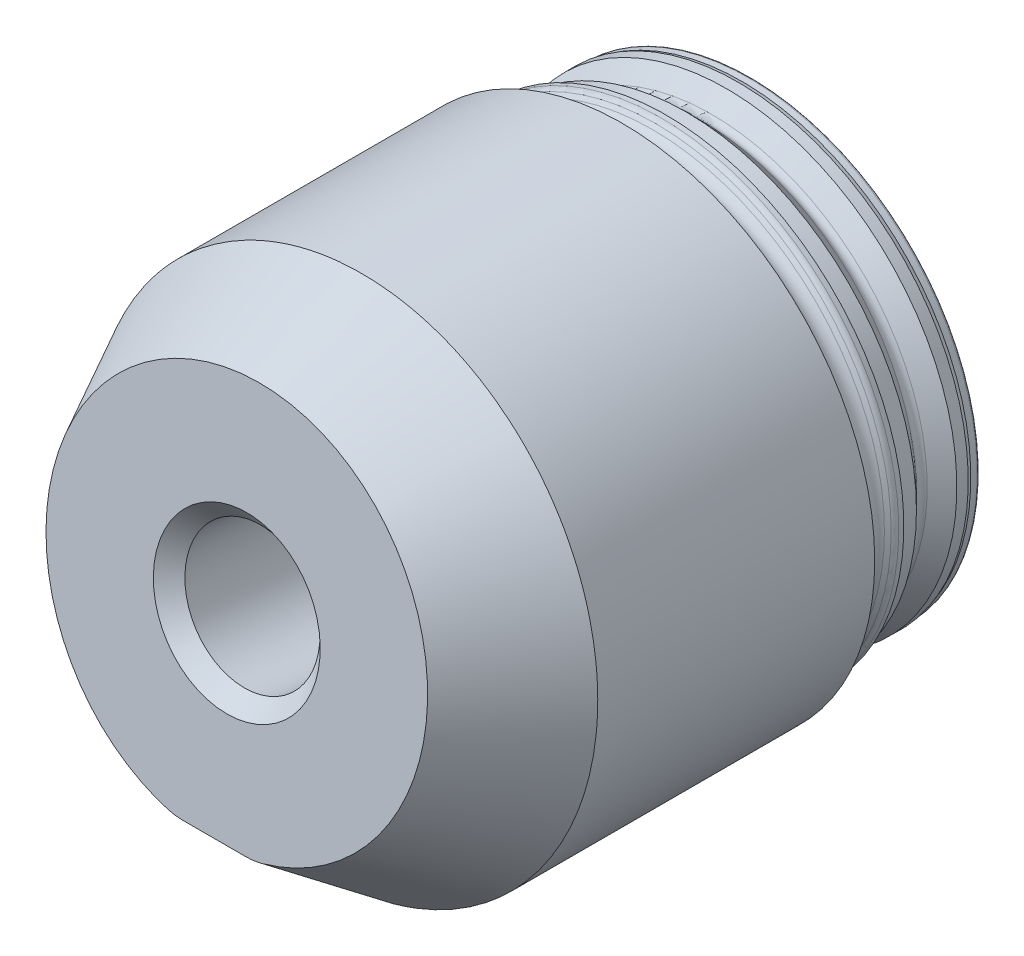
from build123d import *

# Parameters (mm, degrees)
FCE_00_TRIM_END_DEPTH             = 58.943741301
FCE_00_TRIM_END_DEPTH_BACK        = 58.943741301
F_5_8_11_TAPPED_HOLE1_D           = 13.49248
F_5_8_11_TAPPED_HOLE1_DEPTH       = 40.1193
F_5_8_11_TAPPED_HOLE1_CSINK_D     = 16.6624
F_5_8_11_TAPPED_HOLE1_CSINK_ANGLE = 90
F_5_8_11_TAPPED_HOLE1_TIP         = 4.053549943
FCH_00_CHAMFER_0_015_SIZE         = 0.381


with BuildPart() as part:
    # Sketch3 → FBR-00 Basic blank revolve. (revolve)
    with BuildSketch(Plane(origin=(0, 0, 0), x_dir=(0, 0, -1), z_dir=(1, 0, 0)), mode=Mode.PRIVATE) as fbr_00_basic_blank_revolve_sk:
        with BuildLine():
            Line((-45.466, 0), (-12.115698454, 0))
            Line((-12.115698454, 0), (-7.366, 19.05))
            Line((-7.366, 19.05), (8.509, 19.05))
            Line((8.509, 19.05), (8.509, 22.76475))
            ThreePointArc((8.509, 22.76475), (8.434605122, 22.944355122), (8.255, 23.01875))
            Line((8.255, 23.01875), (7.62, 23.01875))
            Line((7.62, 23.01875), (7.239, 23.1394))
            Line((7.239, 23.1394), (6.096, 23.1394))
            Line((6.096, 23.1394), (4.602815367, 21.646215367))
            ThreePointArc((4.602815367, 21.646215367), (4.064, 21.423030735), (3.525184633, 21.646215367))
            Line((3.525184633, 21.646215367), (2.032, 23.1394))
            Line((2.032, 23.1394), (0, 23.1394))
            Line((0, 23.1394), (0, 23.9014))
            Line((0, 23.9014), (-0.508, 23.9014))
            ThreePointArc((-0.508, 23.9014), (-0.799604775, 23.843396204), (-1.046815367, 23.678215367))
            Line((-1.046815367, 23.678215367), (-1.387974388, 23.337056347))
            ThreePointArc((-1.387974388, 23.337056347), (-2.451768264, 22.975946985), (-3.385852263, 23.600081959))
            Line((-3.385852263, 23.600081959), (-4.425035428, 25.4))
            Line((-4.425035428, 25.4), (-45.466, 25.4))
            Line((-45.466, 25.4), (-45.466, 0))
        make_face()
    revolve(fbr_00_basic_blank_revolve_sk.sketch.rotate(Axis((0, 0, -27.766671499), (0, 0, 1)), 90), axis=Axis((0, 0, -27.766671499), (0, 0, 1)))

    # Sketch19 → FCE-00 Trim end. (cut, two sides: drawn at the far end of the back side and taken through both)
    with BuildSketch(Plane(origin=(0, 0, 0), x_dir=(0, 0, -1), z_dir=(1, 0, 0)).offset(-FCE_00_TRIM_END_DEPTH_BACK)):
        Polygon((-68.346920588, -205.891877202), (-47.536496087, -33.923795537), (-39.26053446, 34.465066253), (-18.450109959, 206.433147918), (-362.38627329, 248.05399692), (-412.283083919, -164.271028201), align=None)
    extrude(amount=FCE_00_TRIM_END_DEPTH + FCE_00_TRIM_END_DEPTH_BACK, mode=Mode.SUBTRACT)

    # 5/8-11 Tapped Hole1
    with Locations(Plane(origin=(0, 2.097889548, 43.17739322), x_dir=(0, 0.992757341929, -0.120136838835), z_dir=(0, 0.120136838835, 0.992757341929))):
        with Locations((0, 0)):
            CounterSinkHole(F_5_8_11_TAPPED_HOLE1_D / 2, F_5_8_11_TAPPED_HOLE1_CSINK_D / 2, depth=F_5_8_11_TAPPED_HOLE1_DEPTH, counter_sink_angle=F_5_8_11_TAPPED_HOLE1_CSINK_ANGLE)
            with Locations((0, 0, -(F_5_8_11_TAPPED_HOLE1_DEPTH + F_5_8_11_TAPPED_HOLE1_TIP / 2))):  # 118° drill point
                Cone(0, F_5_8_11_TAPPED_HOLE1_D / 2, F_5_8_11_TAPPED_HOLE1_TIP, mode=Mode.SUBTRACT)

    # FCS-00 Bevel.: sweep along a path in Sketch22
    with BuildLine(Plane(origin=(0, -16.814137816, 45.466), x_dir=(-1, 0, 0), z_dir=(0, -0.11996356816283467, -0.9927782946426865))) as fcs_00_bevel_path:
        Line((-3.175, 0.403277876), (3.175, 0.403277876))
        ThreePointArc((3.175, 0.403277876), (3.975127257, 0.453889304), (4.7625, 0.604916814))
        ThreePointArc((4.7625, 0.604916814), (0, 38.1), (-4.7625, 0.604916814))
        ThreePointArc((-4.7625, 0.604916814), (-3.975127257, 0.453889304), (-3.175, 0.403277876))
    # Sketch31 → FCS-00 Bevel. (sweep, cut)
    with BuildSketch(Plane(origin=(0, 0, 0), x_dir=(0, 0, -1), z_dir=(1, 0, 0))):
        Polygon((-46.883705055, -15.313405584), (-11.697696067, -41.722206608), (-12.459464725, -48.026348779), (-50.284317751, -43.455736832), align=None)
    sweep(path=fcs_00_bevel_path.line, mode=Mode.SUBTRACT)

    # FCH-00 Chamfer 0.015
    fch_00_chamfer_0_015_edges = [part.edges().sort_by_distance(p)[0] for p in [
        (19.05, 0, -8.509),
    ]]
    chamfer(fch_00_chamfer_0_015_edges, length=FCH_00_CHAMFER_0_015_SIZE)


solid = part.part
